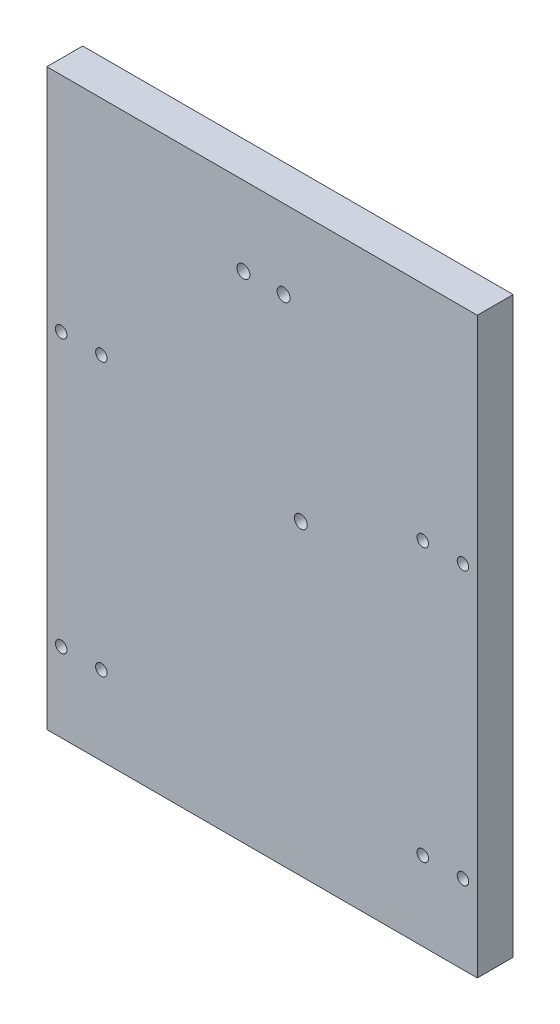
from build123d import *

# Parameters (mm, degrees)
SKETCH1_W           = 300
SKETCH1_H           = 400
SKETCH1_R           = 4
SKETCH1_R_2         = 4.5
BOSS_EXTRUDE1_DEPTH = 25


with BuildPart() as part:
    # Sketch1 → Boss-Extrude1 (new body)
    with BuildSketch(Plane.XY):
        Rectangle(SKETCH1_W, SKETCH1_H)
        with Locations((-112, -145)):
            Circle(SKETCH1_R, mode=Mode.SUBTRACT)
        with Locations((-140, -145)):
            Circle(SKETCH1_R, mode=Mode.SUBTRACT)
        with Locations(Location((112, -145, 0), (0, 0, 180))):
            Circle(SKETCH1_R, mode=Mode.SUBTRACT)
        with Locations(Location((140, -145, 0), (0, 0, 180))):
            Circle(SKETCH1_R, mode=Mode.SUBTRACT)
        with Locations((15, 145)):
            Circle(SKETCH1_R_2, mode=Mode.SUBTRACT)
        with Locations((-13, 145)):
            Circle(SKETCH1_R_2, mode=Mode.SUBTRACT)
        with Locations((27, 14)):
            Circle(SKETCH1_R_2, mode=Mode.SUBTRACT)
        with Locations((140, 45)):
            Circle(SKETCH1_R, mode=Mode.SUBTRACT)
        with Locations((112, 45)):
            Circle(SKETCH1_R, mode=Mode.SUBTRACT)
        with Locations(Location((-112, 45, 0), (0, 0, 180))):
            Circle(SKETCH1_R, mode=Mode.SUBTRACT)
        with Locations(Location((-140, 45, 0), (0, 0, 180))):
            Circle(SKETCH1_R, mode=Mode.SUBTRACT)
    extrude(amount=-BOSS_EXTRUDE1_DEPTH)


solid = part.part
